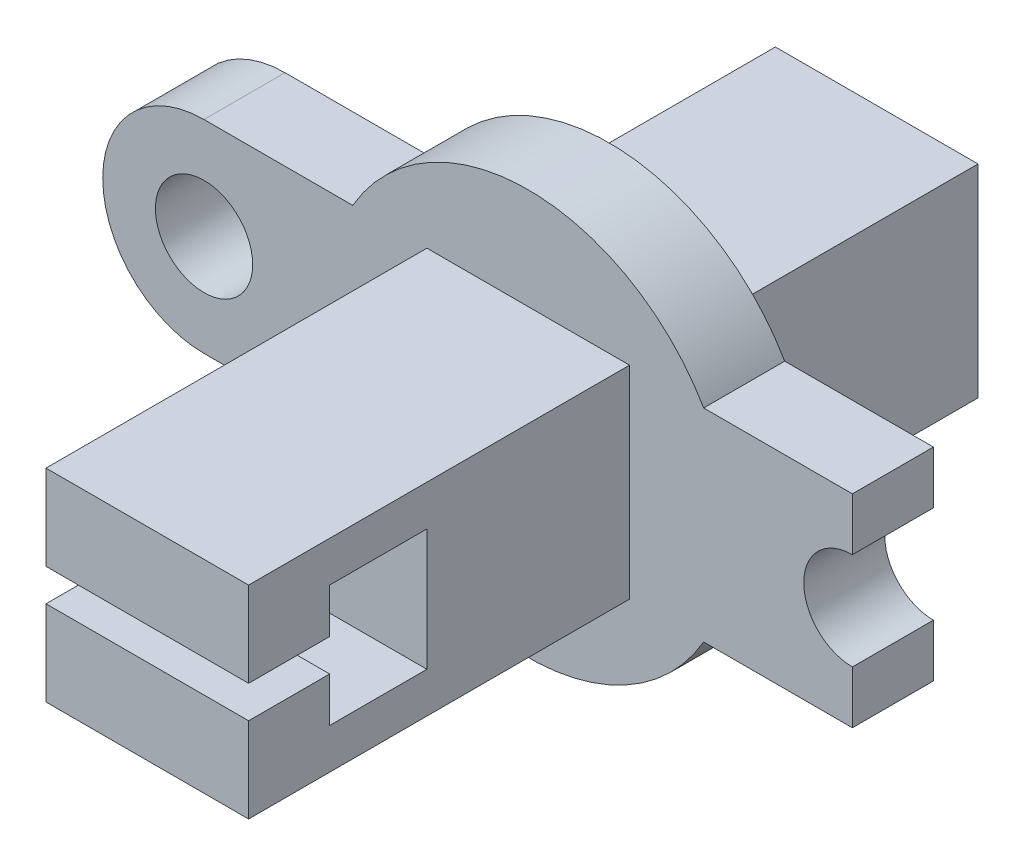
from build123d import *

# Parameters (mm, degrees)
SKETCH_1_W          = 25
SKETCH_1_H          = 25
EXTRUDE_1_DEPTH     = 90
EXTRUDE_START       = 33
SKETCH_1_3_W        = 25
SKETCH_1_3_H        = 25
SKETCH_1_3_R        = 6
EXTRUDE_2_DEPTH     = 10
SKETCH_3_W          = 12
SKETCH_3_H          = 15
SKETCH_3_W_2        = 10
SKETCH_3_H_2        = 4
CUT_EXTRUDE_3_DEPTH = 114.798066767


with BuildPart() as part:
    # Эскиз1 → Бобышка-Вытянуть1 (new body)
    with BuildSketch(Plane.XY):
        Rectangle(SKETCH_1_W, SKETCH_1_H)
    extrude(amount=EXTRUDE_1_DEPTH)

    # Эскиз1<3> → Бобышка-Вытянуть2 (add)
    with BuildSketch(Plane.XY.offset(EXTRUDE_START)):
        with BuildLine():
            Line((-21.650635095, 12.5), (-40, 12.5))
            ThreePointArc((-40, 12.5), (-52.5, 0), (-40, -12.5))
            Line((-40, -12.5), (-21.650635095, -12.5))
            ThreePointArc((-21.650635095, -12.5), (0, -25), (21.650635095, -12.5))
            Line((21.650635095, -12.5), (40, -12.5))
            Line((40, -12.5), (40, -6))
            ThreePointArc((40, -6), (34, 0), (40, 6))
            Line((40, 6), (40, 12.5))
            Line((40, 12.5), (21.650635095, 12.5))
            ThreePointArc((21.650635095, 12.5), (0, 25), (-21.650635095, 12.5))
        make_face()
        Rectangle(SKETCH_1_3_W, SKETCH_1_3_H, mode=Mode.SUBTRACT)
        with Locations((-40, 0)):
            Circle(SKETCH_1_3_R, mode=Mode.SUBTRACT)
    extrude(amount=EXTRUDE_2_DEPTH)

    # Эскиз3 → Вырез-Вытянуть3 (cut, through all)
    with BuildSketch(Plane.ZY.offset(-12.5)):
        with Locations((74, 0)):
            Rectangle(SKETCH_3_W, SKETCH_3_H)
        with Locations((85, 0)):
            Rectangle(SKETCH_3_W_2, SKETCH_3_H_2)
    extrude(amount=CUT_EXTRUDE_3_DEPTH, mode=Mode.SUBTRACT)


solid = part.part
